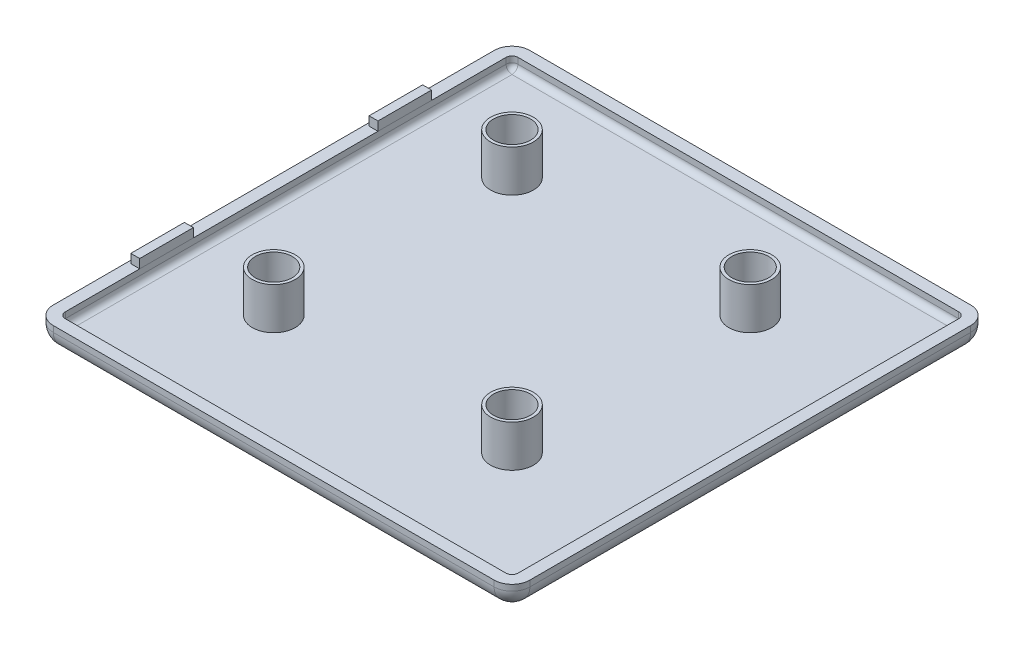
from build123d import *

# Parameters (mm, degrees)
EXTRUDE_1_DEPTH   = 4
FILLET_1_R        = 3
SHELL_1_T         = -2
SKETCH_3_R        = 3.6
SKETCH_3_R_2      = 3.1
EXTRUDE_2_DEPTH   = 7
EXTRUDE_2_2_DEPTH = 7
EXTRUDE_2_3_DEPTH = 7
EXTRUDE_2_4_DEPTH = 7
SKETCH_4_W        = 1.5
SKETCH_4_H        = 9
EXTRUDE_3_DEPTH   = 1.5
EXTRUDE_3_2_DEPTH = 1.5


with BuildPart() as part:
    # 草图1 → 凸台-拉伸1 (new body)
    with BuildSketch(Plane(origin=(0, 0, 0), x_dir=(1, 0, 0), z_dir=(0, 1, 0))):
        with BuildLine():
            Line((2.121320344, -0.878679656), (76.121320344, -0.878679656))
            ThreePointArc((76.121320344, -0.878679656), (78.242640687, 0), (79.121320344, 2.121320344))
            Line((79.121320344, 2.121320344), (79.121320344, 76.121320344))
            ThreePointArc((79.121320344, 76.121320344), (78.242640687, 78.242640687), (76.121320344, 79.121320344))
            Line((76.121320344, 79.121320344), (2.121320344, 79.121320344))
            ThreePointArc((2.121320344, 79.121320344), (0, 78.242640687), (-0.878679656, 76.121320344))
            Line((-0.878679656, 76.121320344), (-0.878679656, 2.121320344))
            ThreePointArc((-0.878679656, 2.121320344), (0, 0), (2.121320344, -0.878679656))
        make_face()
    extrude(amount=EXTRUDE_1_DEPTH)

    # 圆角1
    fillet_1_edges = [part.edges().sort_by_distance(p)[0] for p in [
        (39.121320344, 0, 0.878679656),
        (0, 0, 0),
        (-0.878679656, 0, -39.121320344),
        (0, 0, -78.242640687),
        (39.121320344, 0, -79.121320344),
        (78.242640687, 0, -78.242640687),
        (79.121320344, 0, -39.121320344),
        (78.242640687, 0, 0),
    ]]
    fillet(fillet_1_edges, radius=FILLET_1_R)

    # 抽壳1
    shell_1_openings = [part.faces().sort_by_distance(p)[0] for p in [
        (39.121320344, 4, -39.121320344),
    ]]
    offset(amount=SHELL_1_T, openings=shell_1_openings, kind=Kind.INTERSECTION)


with BuildPart() as body_2:
    # 草图3 → 凸台-拉伸2 (new body)
    with BuildSketch(Plane(origin=(0, 4, 0), x_dir=(1, 0, 0), z_dir=(0, 1, 0))):
        with Locations(Location((19.121320344, 59.121320344, 0), (0, 0, 270))):
            Circle(SKETCH_3_R)
        with Locations(Location((19.121320344, 59.121320344, 0), (0, 0, 270))):
            Circle(SKETCH_3_R_2, mode=Mode.SUBTRACT)
    extrude(amount=EXTRUDE_2_DEPTH)


with BuildPart() as body_3:
    # 草图3 → Extrude 2 2 (new body)
    with BuildSketch(Plane(origin=(0, 4, 0), x_dir=(1, 0, 0), z_dir=(0, 1, 0))):
        with Locations(Location((59.121320344, 59.121320344, 0), (0, 0, 270))):
            Circle(SKETCH_3_R)
        with Locations(Location((59.121320344, 59.121320344, 0), (0, 0, 270))):
            Circle(SKETCH_3_R_2, mode=Mode.SUBTRACT)
    extrude(amount=EXTRUDE_2_2_DEPTH)


with BuildPart() as body_4:
    # 草图3 → Extrude 2 3 (new body)
    with BuildSketch(Plane(origin=(0, 4, 0), x_dir=(1, 0, 0), z_dir=(0, 1, 0))):
        with Locations(Location((59.121320344, 19.121320344, 0), (0, 0, 270))):
            Circle(SKETCH_3_R)
        with Locations(Location((59.121320344, 19.121320344, 0), (0, 0, 270))):
            Circle(SKETCH_3_R_2, mode=Mode.SUBTRACT)
    extrude(amount=EXTRUDE_2_3_DEPTH)


with BuildPart() as body_5:
    # 草图3 → Extrude 2 4 (new body)
    with BuildSketch(Plane(origin=(0, 4, 0), x_dir=(1, 0, 0), z_dir=(0, 1, 0))):
        with Locations(Location((19.121320344, 19.121320344, 0), (0, 0, 270))):
            Circle(SKETCH_3_R)
        with Locations(Location((19.121320344, 19.121320344, 0), (0, 0, 270))):
            Circle(SKETCH_3_R_2, mode=Mode.SUBTRACT)
    extrude(amount=EXTRUDE_2_4_DEPTH)


with BuildPart() as body_6:
    # 草图4 → 凸台-拉伸3 (new body)
    with BuildSketch(Plane(origin=(0, 4, 0), x_dir=(1, 0, 0), z_dir=(0, 1, 0))):
        with Locations((0.371320344, 59.121320344)):
            Rectangle(SKETCH_4_W, SKETCH_4_H)
    extrude(amount=EXTRUDE_3_DEPTH)


with BuildPart() as body_7:
    # 草图4 → Extrude 3 2 (new body)
    with BuildSketch(Plane(origin=(0, 4, 0), x_dir=(1, 0, 0), z_dir=(0, 1, 0))):
        with Locations((0.371320344, 19.121320344)):
            Rectangle(SKETCH_4_W, SKETCH_4_H)
    extrude(amount=EXTRUDE_3_2_DEPTH)


solid = Compound([part.part, body_2.part, body_3.part, body_4.part, body_5.part, body_6.part, body_7.part])
